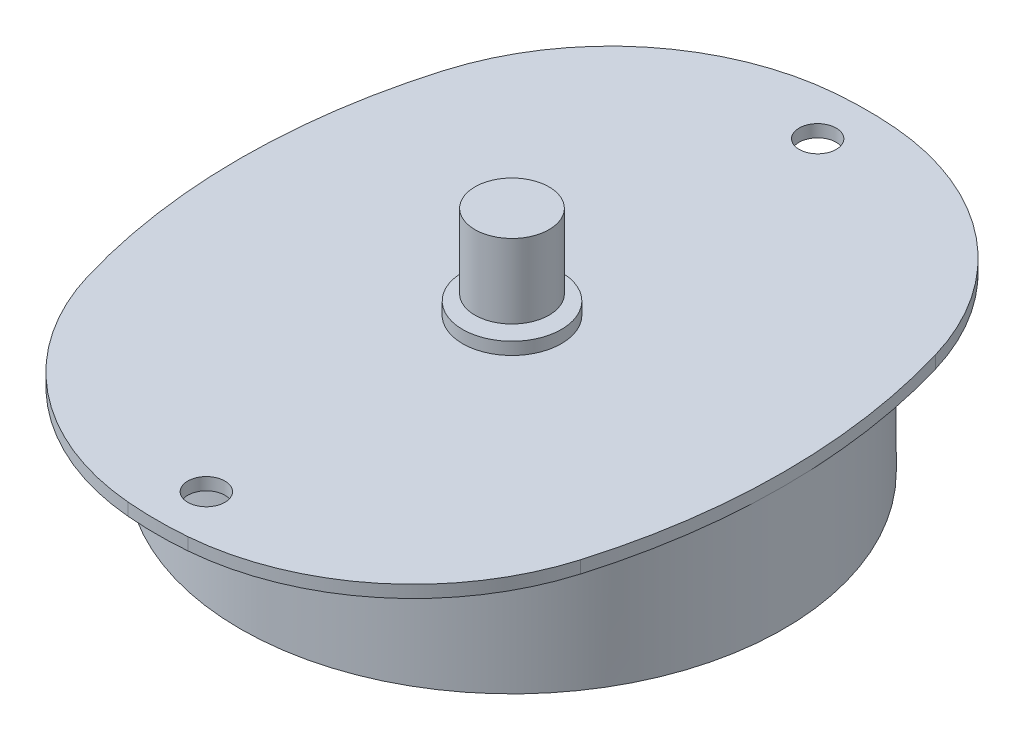
from build123d import *

# Parameters (mm, degrees)
SKETCH1_R           = 22
BOSS_EXTRUDE1_DEPTH = 10
SKETCH2_R           = 28.75
BOSS_EXTRUDE2_DEPTH = 1
SKETCH3_R           = 1.5
CUT_EXTRUDE1_DEPTH  = 1
CUT_EXTRUDE2_DEPTH  = 1
FILLET1_R           = 20
SKETCH5_R           = 4
BOSS_EXTRUDE3_DEPTH = 1
SKETCH6_R           = 1
BOSS_EXTRUDE4_DEPTH = 0.5
SKETCH7_R           = 3
BOSS_EXTRUDE5_DEPTH = 6


with BuildPart() as part:
    # Sketch1 → Boss-Extrude1 (new body)
    with BuildSketch(Plane(origin=(0, 0, 0), x_dir=(1, 0, 0), z_dir=(0, 1, 0))):
        with Locations(Location((0, 0, 0), (0, 0, 270))):
            Circle(SKETCH1_R)
    extrude(amount=BOSS_EXTRUDE1_DEPTH)

    # Sketch2 → Boss-Extrude2 (add)
    with BuildSketch(Plane(origin=(0, 10, 0), x_dir=(1, 0, 0), z_dir=(0, 1, 0))):
        with Locations(Location((0, 0, 0), (0, 0, 270))):
            Circle(SKETCH2_R)
    extrude(amount=BOSS_EXTRUDE2_DEPTH)

    # Sketch3 → Cut-Extrude1 (cut)
    with BuildSketch(Plane(origin=(0, 11, 0), x_dir=(1, 0, 0), z_dir=(0, 1, 0))):
        with Locations(Location((0, -24.75, 0), (0, 0, 270))):
            Circle(SKETCH3_R)
        with Locations(Location((0, 24.75, 0), (0, 0, 270))):
            Circle(SKETCH3_R)
    extrude(amount=-CUT_EXTRUDE1_DEPTH, mode=Mode.SUBTRACT)

    # Sketch4 → Cut-Extrude2 (cut)
    with BuildSketch(Plane.XZ.offset(-10)):
        with BuildLine():
            ThreePointArc((-16.042391304, -23.858000361), (-22, 0), (-16.042391304, 23.858000361))
            ThreePointArc((-16.042391304, 23.858000361), (-28.75, 0), (-16.042391304, -23.858000361))
        make_face()
        with BuildLine():
            ThreePointArc((16.042391304, -23.858000361), (28.75, 0), (16.042391304, 23.858000361))
            ThreePointArc((16.042391304, 23.858000361), (22, 0), (16.042391304, -23.858000361))
        make_face()
    extrude(amount=-CUT_EXTRUDE2_DEPTH, mode=Mode.SUBTRACT)

    # Fillet1
    fillet1_edges = [part.edges().sort_by_distance(p)[0] for p in [
        (-16.042391304, 10.5, 23.858000361),
        (-16.042391304, 10.5, -23.858000361),
        (16.042391304, 10.5, -23.858000361),
        (16.042391304, 10.5, 23.858000361),
    ]]
    fillet(fillet1_edges, radius=FILLET1_R)

    # Sketch5 → Boss-Extrude3 (add)
    with BuildSketch(Plane(origin=(0, 11, 0), x_dir=(1, 0, 0), z_dir=(0, 1, 0))):
        with Locations(Location((0, 0, 0), (0, 0, 270))):
            Circle(SKETCH5_R)
    extrude(amount=BOSS_EXTRUDE3_DEPTH)

    # Sketch6 → Boss-Extrude4 (add)
    with BuildSketch(Plane(origin=(0, 12, 0), x_dir=(1, 0, 0), z_dir=(0, 1, 0))):
        with Locations(Location((0, 0, 0), (0, 0, 270))):
            Circle(SKETCH6_R)
    extrude(amount=BOSS_EXTRUDE4_DEPTH)

    # Sketch7 → Boss-Extrude5 (add)
    with BuildSketch(Plane(origin=(0, 12.5, 0), x_dir=(1, 0, 0), z_dir=(0, 1, 0))):
        with Locations(Location((0, 0, 0), (0, 0, 270))):
            Circle(SKETCH7_R)
    extrude(amount=BOSS_EXTRUDE5_DEPTH)


solid = part.part
